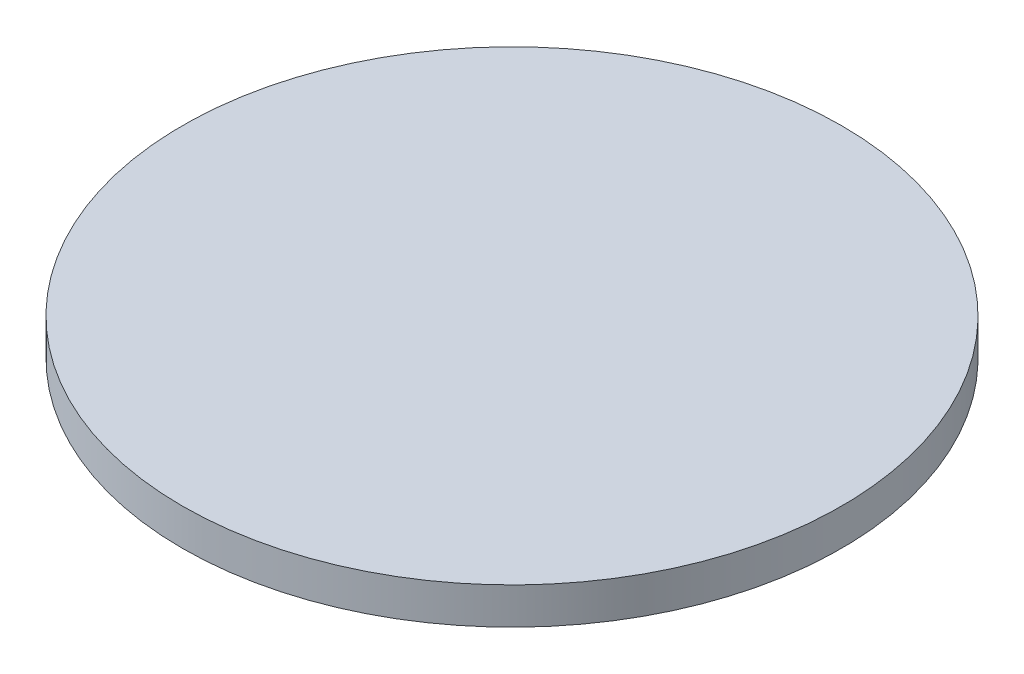
from build123d import *

# Parameters (mm, degrees)
SKETCH1_R           = 90
BOSS_EXTRUDE1_DEPTH = 10


with BuildPart() as part:
    # Sketch1 → Boss-Extrude1 (new body)
    with BuildSketch(Plane(origin=(0, 0, 0), x_dir=(1, 0, 0), z_dir=(0, 1, 0))):
        with Locations(Location((0, 0, 0), (0, 0, 270))):
            Circle(SKETCH1_R)
    extrude(amount=BOSS_EXTRUDE1_DEPTH)


solid = part.part
